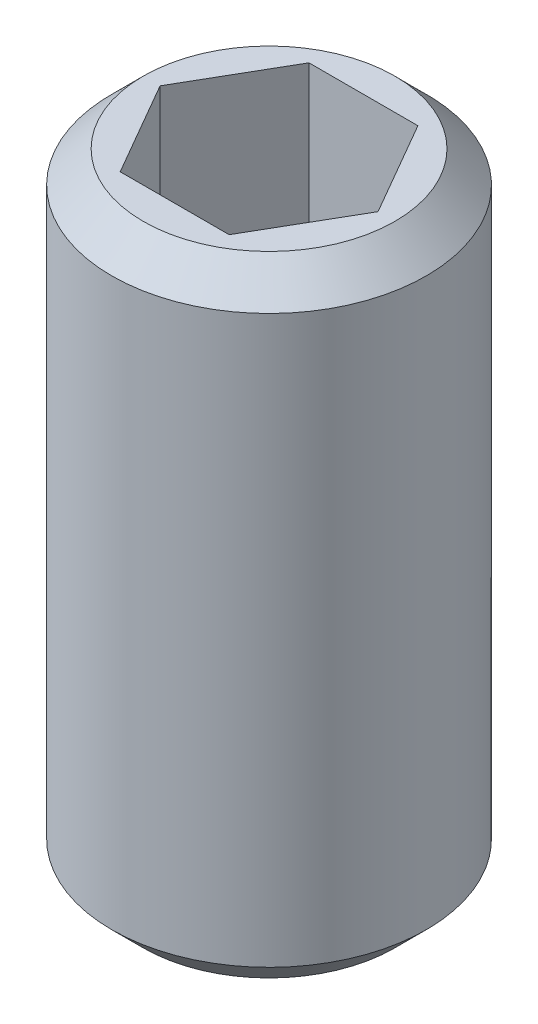
from build123d import *

# Parameters (mm, degrees)
SZKIC1_R                    = 2.5
DODANIE_WYCI_GNI_CIE1_DEPTH = 10
WYTNIJ_WYCI_GNI_CIE1_DEPTH  = 3
SFAZOWANIE1_SIZE            = 0.5


with BuildPart() as part:
    # Szkic1 → Dodanie-wyciągnięcie1 (new body)
    with BuildSketch(Plane(origin=(0, 0, 0), x_dir=(1, 0, 0), z_dir=(0, 1, 0))):
        with Locations(Location((42.20752559, 13.113324094, 0), (0, 0, 270))):
            Circle(SZKIC1_R)
    extrude(amount=DODANIE_WYCI_GNI_CIE1_DEPTH)

    # Szkic2 → Wytnij-wyciągnięcie1 (cut)
    with BuildSketch(Plane(origin=(0, 10, 0), x_dir=(1, 0, 0), z_dir=(0, 1, 0))):
        Polygon((43.939576398, 13.113324094), (43.073550994, 14.613324094), (41.341500186, 14.613324094), (40.475474782, 13.113324094), (41.341500186, 11.613324094), (43.073550994, 11.613324094), align=None)
    extrude(amount=-WYTNIJ_WYCI_GNI_CIE1_DEPTH, mode=Mode.SUBTRACT)

    # Sfazowanie1
    sfazowanie1_edges = [part.edges().sort_by_distance(p)[0] for p in [
        (42.20752559, 0, -15.613324094),
        (42.20752559, 10, -15.613324094),
    ]]
    chamfer(sfazowanie1_edges, length=SFAZOWANIE1_SIZE)


solid = part.part
